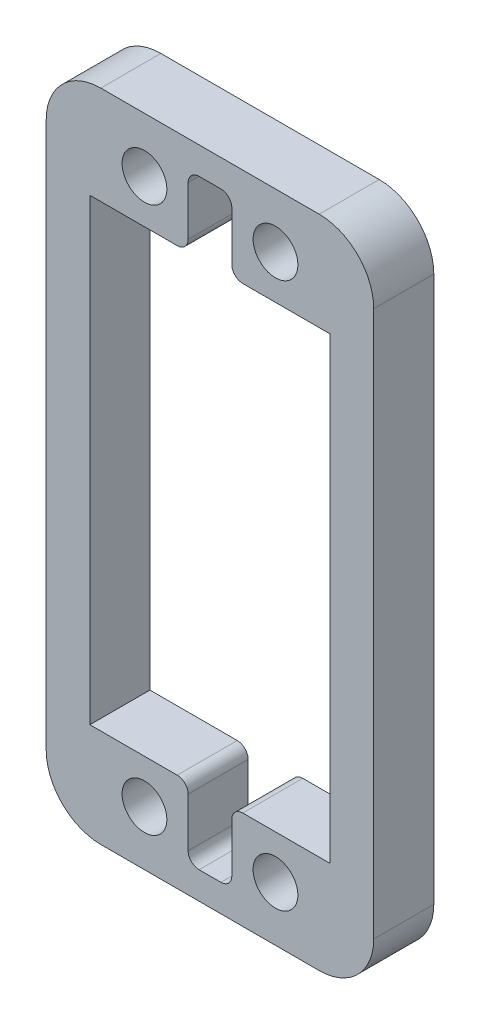
from build123d import *

# Parameters (mm, degrees)
CROQUIS1_W              = 30
CROQUIS1_H              = 60
SALIENTE_EXTRUIR1_DEPTH = 5.5
CROQUIS2_W              = 22
CROQUIS2_H              = 42
CORTAR_EXTRUIR1_DEPTH   = 34.988968799
CROQUIS3_R              = 2.05
CORTAR_EXTRUIR2_DEPTH   = 34.988968799
REDONDEO1_R             = 5
REDONDEO3_R             = 1


with BuildPart() as part:
    # Croquis1 → Saliente-Extruir1 (new body)
    with BuildSketch(Plane.XY):
        Rectangle(CROQUIS1_W, CROQUIS1_H)
    extrude(amount=SALIENTE_EXTRUIR1_DEPTH)

    # Croquis2 → Cortar-Extruir1 (cut, through all)
    with BuildSketch(Plane(origin=(0, 0, 0), x_dir=(-1, 0, 0), z_dir=(0, 0, -1))):
        Rectangle(CROQUIS2_W, CROQUIS2_H)
    extrude(amount=-CORTAR_EXTRUIR1_DEPTH, mode=Mode.SUBTRACT)

    # Croquis3 → Cortar-Extruir2 (cut, through all)
    with BuildSketch(Plane(origin=(0, 0, 0), x_dir=(-1, 0, 0), z_dir=(0, 0, -1))):
        with Locations((-6, 25)):
            Circle(CROQUIS3_R)
        with Locations((6, 25)):
            Circle(CROQUIS3_R)
        with Locations((-6, -25)):
            Circle(CROQUIS3_R)
        with Locations((6, -25)):
            Circle(CROQUIS3_R)
        Polygon((-2, 21), (-2, 27.5), (2, 27.5), (2, -27.5), (-2, -27.5), align=None)
    extrude(amount=-CORTAR_EXTRUIR2_DEPTH, mode=Mode.SUBTRACT)

    # Redondeo1
    redondeo1_edges = [part.edges().sort_by_distance(p)[0] for p in [
        (-15, 30, 2.75),
        (15, 30, 2.75),
        (15, -30, 2.75),
        (-15, -30, 2.75),
    ]]
    fillet(redondeo1_edges, radius=REDONDEO1_R)

    # Redondeo3
    redondeo3_edges = [part.edges().sort_by_distance(p)[0] for p in [
        (2, -21, 2.75),
        (-2, -21, 2.75),
        (-2, 21, 2.75),
        (-2, 27.5, 2.75),
        (2, 21, 2.75),
        (2, -27.5, 2.75),
        (-2, -27.5, 2.75),
        (2, 27.5, 2.75),
    ]]
    fillet(redondeo3_edges, radius=REDONDEO3_R)


solid = part.part
